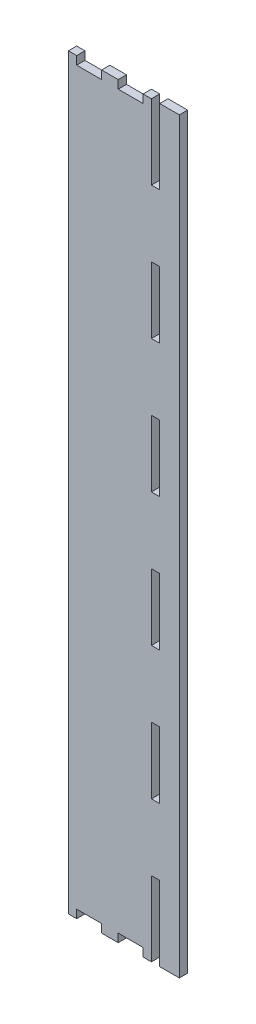
from build123d import *

# Parameters (mm, degrees)
SKETCH1_W           = 5
SKETCH1_H           = 40
BOSS_EXTRUDE1_DEPTH = 5


with BuildPart() as part:
    # Sketch1 → Boss-Extrude1 (new body)
    with BuildSketch(Plane.XY):
        Polygon((203.486718192, 206.341782002), (191.685694536, 206.341782002), (191.685694536, 161.341782002), (186.685694536, 161.341782002), (186.685694536, 206.341782002), (181.685694536, 206.341782002), (181.685694536, 201.341782002), (166.685694536, 201.341782002), (166.685694536, 206.341782002), (156.685694536, 206.341782002), (156.685694536, 201.341782002), (141.685694536, 201.341782002), (141.685694536, 206.341782002), (136.685694536, 206.341782002), (136.685694536, -243.658217998), (141.685694536, -243.658217998), (141.685694536, -238.658217998), (156.685694536, -238.658217998), (156.685694536, -243.658217998), (166.685694536, -243.658217998), (166.685694536, -238.658217998), (181.685694536, -238.658217998), (181.685694536, -243.658217998), (186.685694536, -243.658217998), (186.685694536, -198.658217998), (191.685694536, -198.658217998), (191.685694536, -243.658217998), (203.486718192, -243.658217998), align=None)
        with Locations((189.185694536, -138.658217998)):
            Rectangle(SKETCH1_W, SKETCH1_H, mode=Mode.SUBTRACT)
        with Locations((189.185694536, -58.658217998)):
            Rectangle(SKETCH1_W, SKETCH1_H, mode=Mode.SUBTRACT)
        with Locations((189.185694536, 21.341782002)):
            Rectangle(SKETCH1_W, SKETCH1_H, mode=Mode.SUBTRACT)
        with Locations((189.185694536, 101.341782002)):
            Rectangle(SKETCH1_W, SKETCH1_H, mode=Mode.SUBTRACT)
    extrude(amount=BOSS_EXTRUDE1_DEPTH)


solid = part.part
